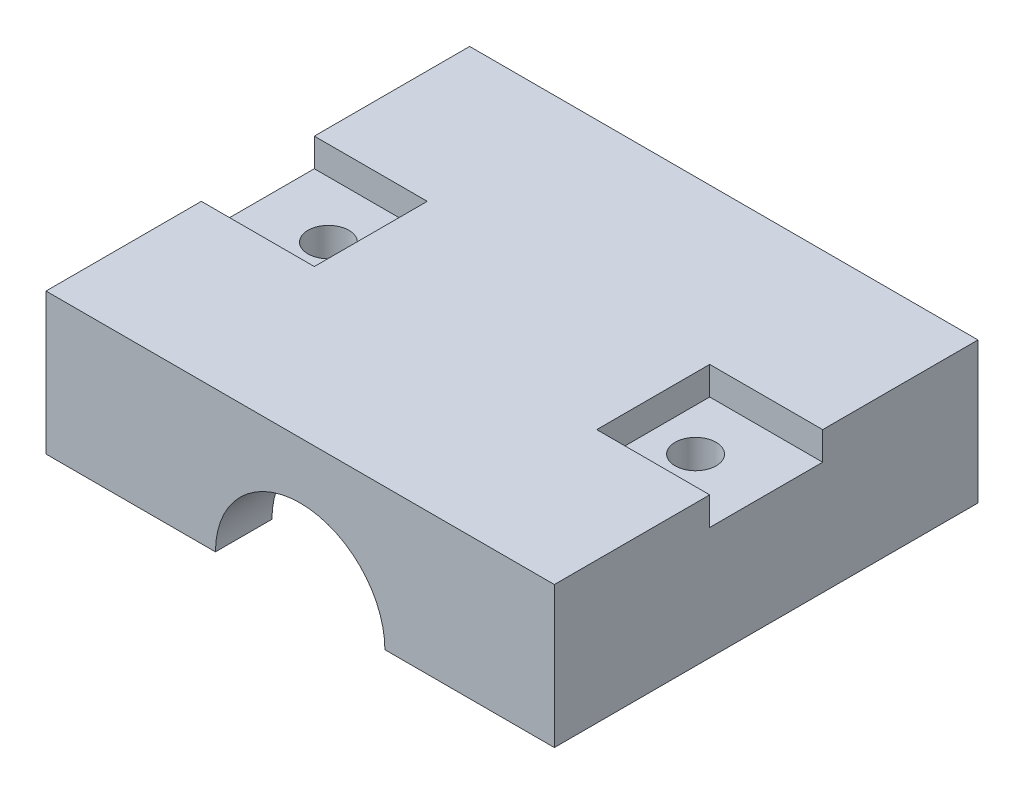
from build123d import *

# Parameters (mm, degrees)
SKETCH_2_W          = 36
SKETCH_2_H          = 30
EXTRUDE_1_DEPTH     = 10
SKETCH_3_R          = 6
CUT_EXTRUDE_1_DEPTH = 20
SKETCH_4_R          = 8.1
CUT_EXTRUDE_2_DEPTH = 5.2
SKETCH_5_R          = 1.45
CUT_EXTRUDE_3_DEPTH = 8
SKETCH_6_W          = 8
SKETCH_6_H          = 8
CUT_EXTRUDE_4_DEPTH = 8
CUT_EXTRUDE_5_DEPTH = 9.2
EXTRUDE_2_DEPTH     = 4


with BuildPart() as part:
    # 草图2 → 凸台-拉伸1 (new body)
    with BuildSketch(Plane(origin=(0, 0, 0), x_dir=(1, 0, 0), z_dir=(0, 1, 0))):
        with Locations((-18, 15)):
            Rectangle(SKETCH_2_W, SKETCH_2_H)
    extrude(amount=EXTRUDE_1_DEPTH)

    # 草图3 → 切除-拉伸1 (cut)
    with BuildSketch(Plane.XY):
        with Locations((-18, 0)):
            Circle(SKETCH_3_R)
    extrude(amount=-CUT_EXTRUDE_1_DEPTH, mode=Mode.SUBTRACT)

    # 草图4 → 切除-拉伸2 (cut)
    with BuildSketch(Plane.XY.offset(-20)):
        with Locations((-18, 0)):
            Circle(SKETCH_4_R)
    extrude(amount=-CUT_EXTRUDE_2_DEPTH, mode=Mode.SUBTRACT)

    # 草图5 → 切除-拉伸3 (cut)
    with BuildSketch(Plane.XZ):
        with Locations(Location((-31, -15, 0), (0, 0, 270))):
            Circle(SKETCH_5_R)
        with Locations(Location((-5, -15, 0), (0, 0, 90))):
            Circle(SKETCH_5_R)
    extrude(amount=-CUT_EXTRUDE_3_DEPTH, mode=Mode.SUBTRACT)

    # 草图6 → 切除-拉伸4 (cut)
    with BuildSketch(Plane.XZ.offset(-8)):
        with Locations((-32, -15)):
            Rectangle(SKETCH_6_W, SKETCH_6_H)
        with Locations((-4, -15)):
            Rectangle(SKETCH_6_W, SKETCH_6_H)
    extrude(amount=-CUT_EXTRUDE_4_DEPTH, mode=Mode.SUBTRACT)

    # 草图7 → 切除-拉伸5 (cut)
    with BuildSketch(Plane.XY):
        with BuildLine():
            Line((-26.1, 0), (-9.9, 0))
            ThreePointArc((-9.9, 0), (-18, 8.1), (-26.1, 0))
        make_face()
    extrude(amount=-CUT_EXTRUDE_5_DEPTH, mode=Mode.SUBTRACT)

    # 草图8 → 凸台-拉伸2 (add)
    with BuildSketch(Plane.XY):
        with BuildLine():
            Line((-12, 0), (-9.9, 0))
            ThreePointArc((-9.9, 0), (-18, 8.1), (-26.1, 0))
            Line((-26.1, 0), (-24, 0))
            ThreePointArc((-24, 0), (-18, 6), (-12, 0))
        make_face()
    extrude(amount=-EXTRUDE_2_DEPTH)


solid = part.part
